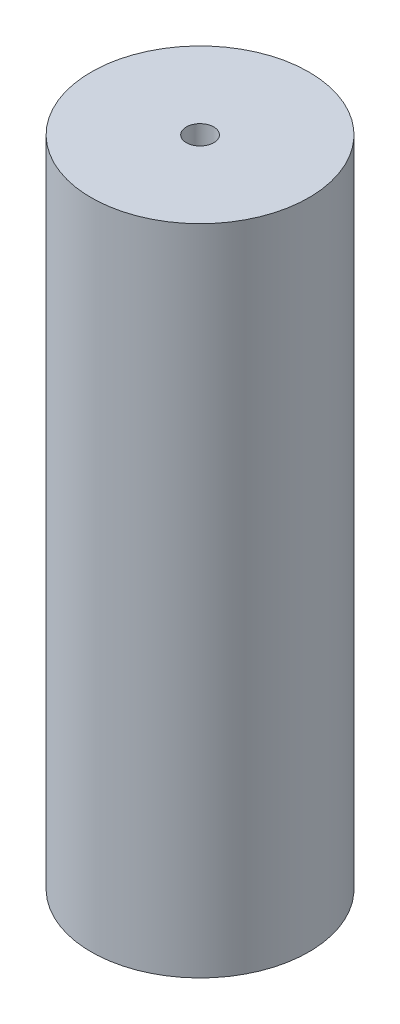
from build123d import *

# Parameters (mm, degrees)
SKETCH1_R                 = 6.35
BOSS_EXTRUDE1_DEPTH       = 38.1
M2X0_4_TAPPED_HOLE1_D     = 1.6
M2X0_4_TAPPED_HOLE1_DEPTH = 2.032
M2X0_4_TAPPED_HOLE1_TIP   = 0.480688495


with BuildPart() as part:
    # Sketch1 → Boss-Extrude1 (new body)
    with BuildSketch(Plane(origin=(0, 0, 0), x_dir=(1, 0, 0), z_dir=(0, 1, 0))):
        with Locations(Location((0, 0, 0), (0, 0, 90))):
            Circle(SKETCH1_R)
    extrude(amount=BOSS_EXTRUDE1_DEPTH)

    # M2x0.4 Tapped Hole1
    with Locations(Plane(origin=(0, 38.1, 0), x_dir=(1, 0, 0), z_dir=(0, 1, 0))):
        with Locations((0, 0)):
            Hole(M2X0_4_TAPPED_HOLE1_D / 2, depth=M2X0_4_TAPPED_HOLE1_DEPTH)
            with Locations((0, 0, -(M2X0_4_TAPPED_HOLE1_DEPTH + M2X0_4_TAPPED_HOLE1_TIP / 2))):  # 118° drill point
                Cone(0, M2X0_4_TAPPED_HOLE1_D / 2, M2X0_4_TAPPED_HOLE1_TIP, mode=Mode.SUBTRACT)


solid = part.part
